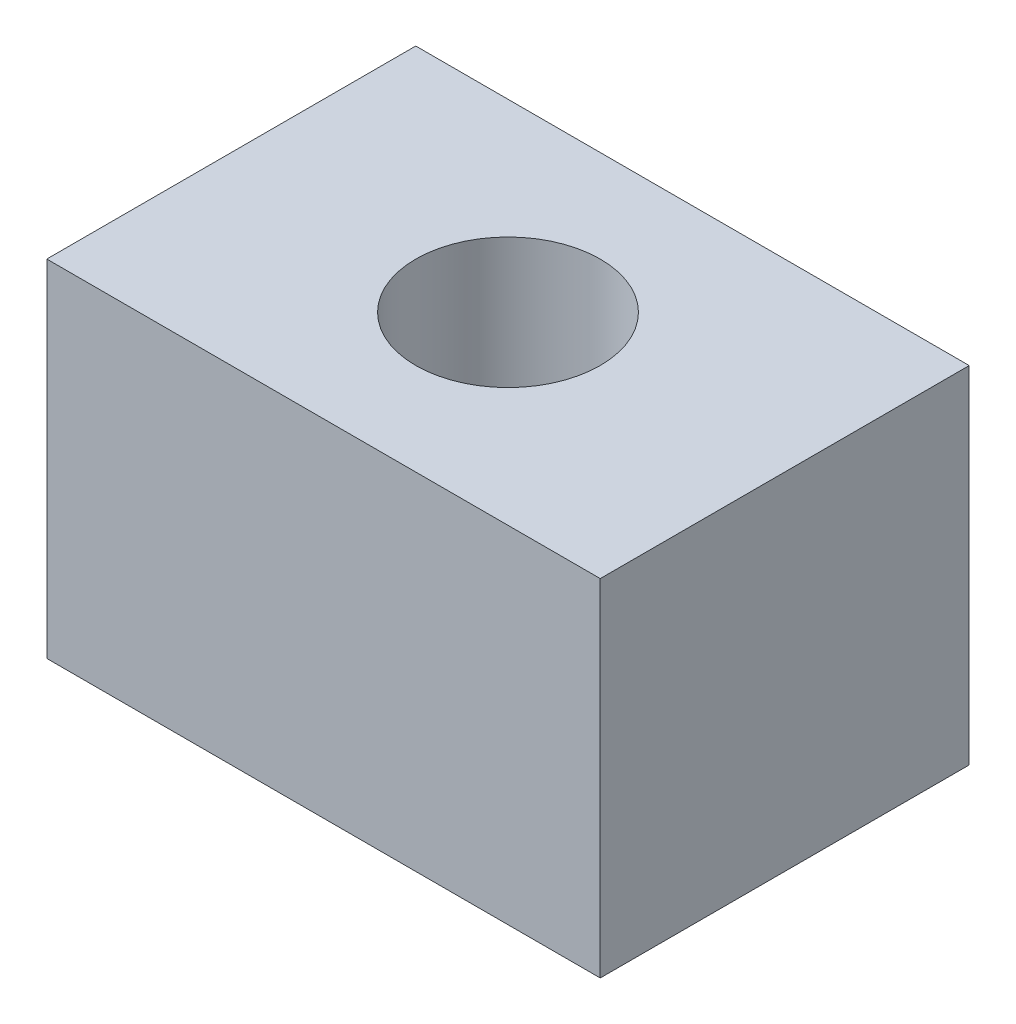
from build123d import *

# Parameters (mm, degrees)
SKETCH1_W           = 15.24
SKETCH1_H           = 10.16
BOSS_EXTRUDE1_DEPTH = 9.525
SKETCH2_R           = 2.54
CUT_EXTRUDE1_DEPTH  = 21.644825623


with BuildPart() as part:
    # Sketch1 → Boss-Extrude1 (new body)
    with BuildSketch(Plane(origin=(0, 0, 0), x_dir=(1, 0, 0), z_dir=(0, 1, 0))):
        with Locations((7.62, 5.08)):
            Rectangle(SKETCH1_W, SKETCH1_H)
    extrude(amount=BOSS_EXTRUDE1_DEPTH)

    # Sketch2 → Cut-Extrude1 (cut, through all)
    with BuildSketch(Plane(origin=(0, 9.525, 0), x_dir=(1, 0, 0), z_dir=(0, 1, 0))):
        with Locations(Location((7.62, 5.08, 0), (0, 0, 270))):
            Circle(SKETCH2_R)
    extrude(amount=-CUT_EXTRUDE1_DEPTH, mode=Mode.SUBTRACT)


solid = part.part
